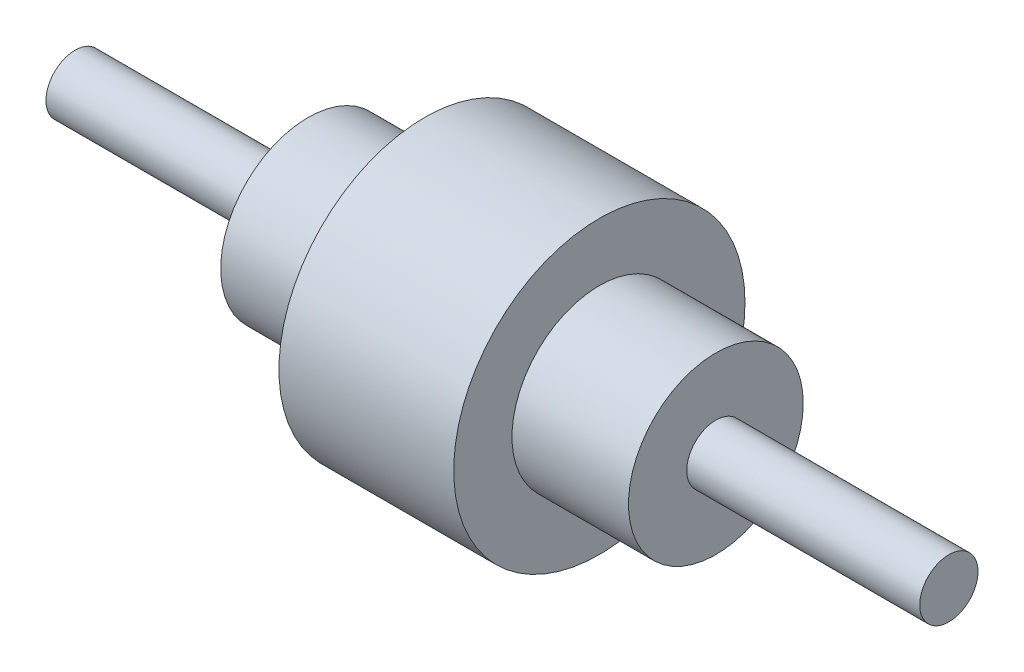
from build123d import *

# Parameters (mm, degrees)
SKETCH_1_W = 80
SKETCH_1_H = 10


with BuildPart() as part:
    # 草圖1 → 迴轉1 (revolve)
    with BuildSketch(Plane.XY, mode=Mode.PRIVATE) as revolve_1_sk:
        with Locations((140, 5)):
            Rectangle(SKETCH_1_W, SKETCH_1_H)
        with Locations((-80, 5)):
            Rectangle(SKETCH_1_W, SKETCH_1_H)
        Polygon((60, 0), (100, 0), (100, 10), (100, 30), (60, 30), align=None)
        Polygon((-40, 0), (0, 0), (0, 30), (-40, 30), (-40, 10), align=None)
        Polygon((0, 0), (60, 0), (60, 30), (60, 50), (0, 50), (0, 30), align=None)
    revolve(revolve_1_sk.sketch.rotate(Axis((0, 0, 0), (-1, 0, 0)), 90), axis=Axis((0, 0, 0), (-1, 0, 0)))


solid = part.part
